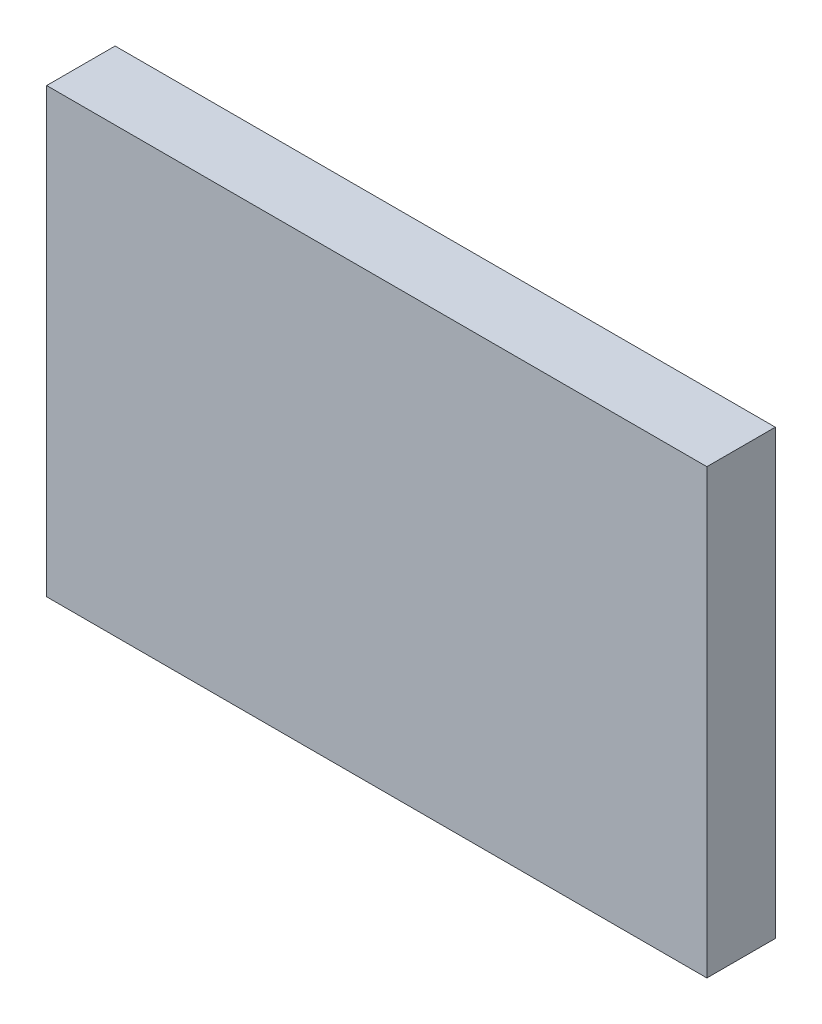
from build123d import *

# Parameters (mm, degrees)
ESQUISSE1_W        = 82
ESQUISSE1_H        = 55
BOSS_EXTRU_1_DEPTH = 8.5


with BuildPart() as part:
    # Esquisse1 → Boss.-Extru.1 (new body)
    with BuildSketch(Plane.XY):
        with Locations((4.031502285, -7.654255319)):
            Rectangle(ESQUISSE1_W, ESQUISSE1_H)
    extrude(amount=BOSS_EXTRU_1_DEPTH)


solid = part.part
